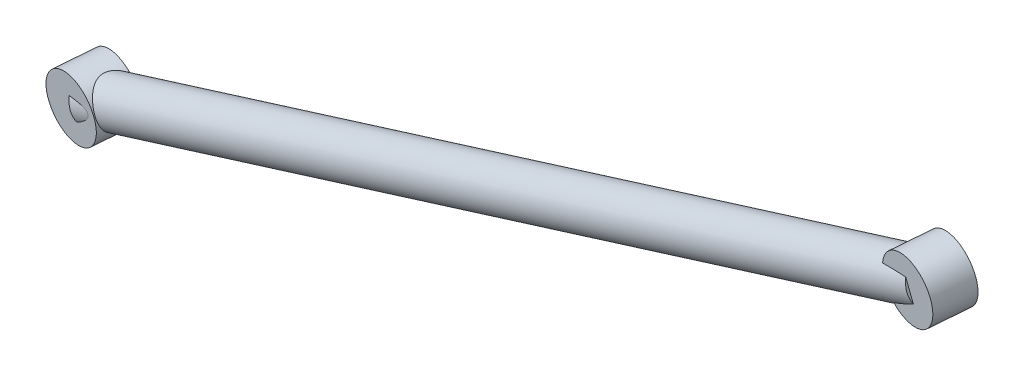
from build123d import *

# Parameters (mm, degrees)
SUSP_FL_TIE_ROD_PROFILE_R             = 8
SUSP_FL_TIE_ROD_ROD_END_IN_PROFILE_R  = 11
SUSP_FL_TIE_ROD_ROD_END_OUT_PROFILE_R = 11


with BuildPart() as part:
    # SUSP_FL_tie_rod: sweep along a curve in space
    with BuildLine() as susp_fl_tie_rod_path:
        Line((-270, -90.4, -82.3915), (-590.293517, -204.990503, -103.750386))
    # SUSP_FL_tie_rod profile (on start of the path) → SUSP_FL_tie_rod (sweep)
    with BuildSketch(Plane(origin=(-270, -90.4, -82.3915), x_dir=(0.33685766905299525, -0.9415555803032463, 0), z_dir=(-0.9397050891891743, -0.3361956240964046, -0.06266456487038859))):
        Circle(SUSP_FL_TIE_ROD_PROFILE_R)
    sweep(path=susp_fl_tie_rod_path.line)

    # SUSP_FL_tie_rod_rod_end_in: sweep along a curve in space
    with BuildLine() as susp_fl_tie_rod_rod_end_in_path:
        Line((-271.21105, -91.0008904, -75.5232915), (-268.78895, -89.7991096, -89.2597085))
    # SUSP_FL_tie_rod_rod_end_in profile (on start of the path) → SUSP_FL_tie_rod_rod_end_in (sweep)
    with BuildSketch(Plane(origin=(-271.21105, -91.0008904, -75.5232915), x_dir=(-0.9848077644799927, 0, -0.17364811262987942), z_dir=(0.17300714396088532, 0.08584148626193362, -0.9811726491167799))):
        Circle(SUSP_FL_TIE_ROD_ROD_END_IN_PROFILE_R)
    sweep(path=susp_fl_tie_rod_rod_end_in_path.line)

    # SUSP_FL_tie_rod_rod_end_out: sweep along a curve in space
    with BuildLine() as susp_fl_tie_rod_rod_end_out_path:
        Line((-591.504567, -205.591393, -96.882177), (-589.082466, -204.389612, -110.618594))
    # SUSP_FL_tie_rod_rod_end_out profile (on start of the path) → SUSP_FL_tie_rod_rod_end_out (sweep)
    with BuildSketch(Plane(origin=(-591.504567, -205.591393, -96.882177), x_dir=(-0.9848077522197362, 0, -0.17364818216126232), z_dir=(0.17300721303932562, 0.08584149938158056, -0.9811726357885688))):
        Circle(SUSP_FL_TIE_ROD_ROD_END_OUT_PROFILE_R)
    sweep(path=susp_fl_tie_rod_rod_end_out_path.line)


solid = part.part
